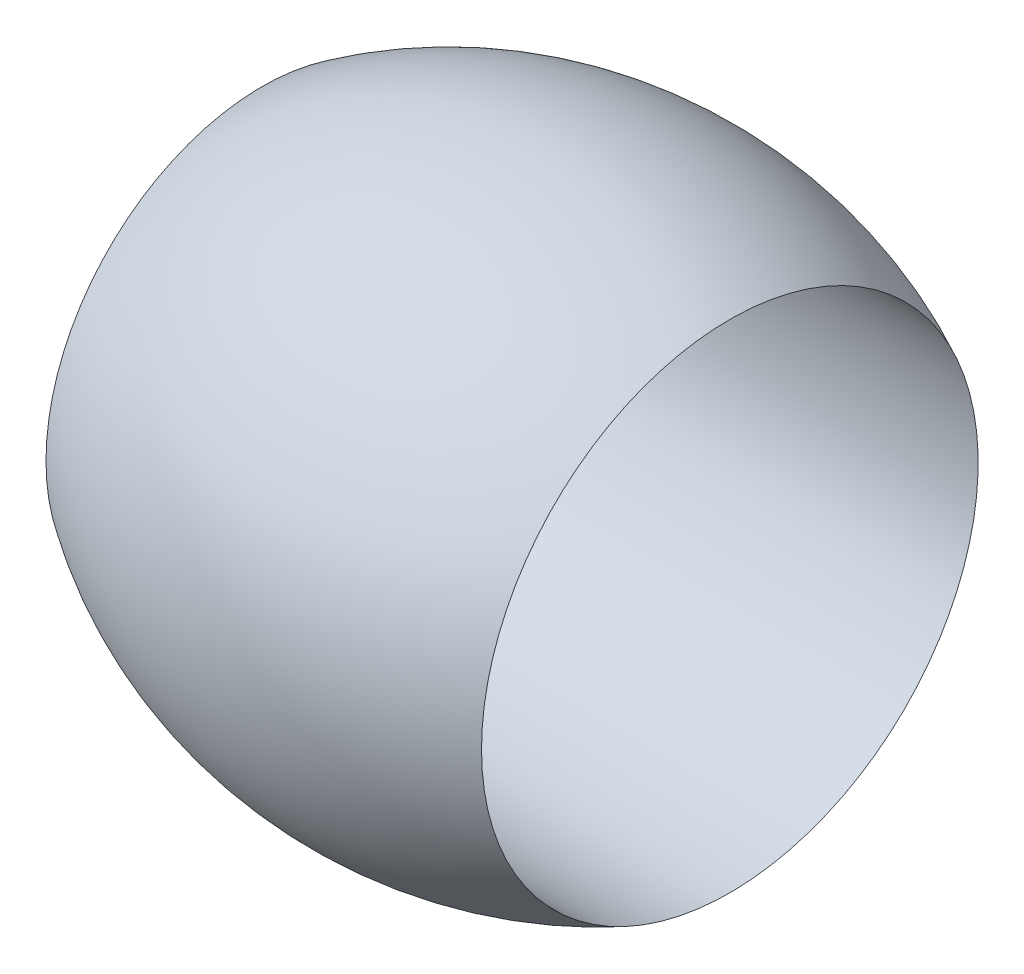
from build123d import *

# Parameters (mm, degrees)
FILLET1_R = 2.54


with BuildPart() as part:
    # Sketch1 → Revolve1 (revolve)
    with BuildSketch(Plane.XY, mode=Mode.PRIVATE) as revolve1_sk:
        with BuildLine():
            Line((-38.608, 0), (-38.608, 22.86))
            Line((-38.608, 22.86), (-41.91, 22.86))
            Line((-41.91, 22.86), (-42.21, 22.86))
            Line((-42.21, 22.86), (-42.21, 31.75))
            Line((-42.21, 31.75), (-41.91, 31.75))
            Line((-41.91, 31.75), (-41.91, 36.0045))
            Line((-41.91, 36.0045), (-30.226, 36.0045))
            Line((-30.226, 36.0045), (-30.226, 43.427437066))
            Line((-30.226, 43.427437066), (36.078077203, 43.427437066))
            ThreePointArc((36.078077203, 43.427437066), (-5.583158711, 51.681323799), (-45.72, 37.795388634))
            Line((-45.72, 37.795388634), (-45.72, 19.05))
            Line((-45.72, 19.05), (-42.418, 19.05))
            Line((-42.418, 19.05), (-42.418, 0))
            Line((-42.418, 0), (-38.608, 0))
        make_face()
    revolve(revolve1_sk.sketch.rotate(Axis((-42.418, 0, 0), (1, 0, 0)), 90), axis=Axis((-42.418, 0, 0), (1, 0, 0)))

    # Fillet1
    fillet1_edges = [part.edges().sort_by_distance(p)[0] for p in [
        (-30.226, 0, -43.427437066),
    ]]
    fillet(fillet1_edges, radius=FILLET1_R)


solid = part.part
